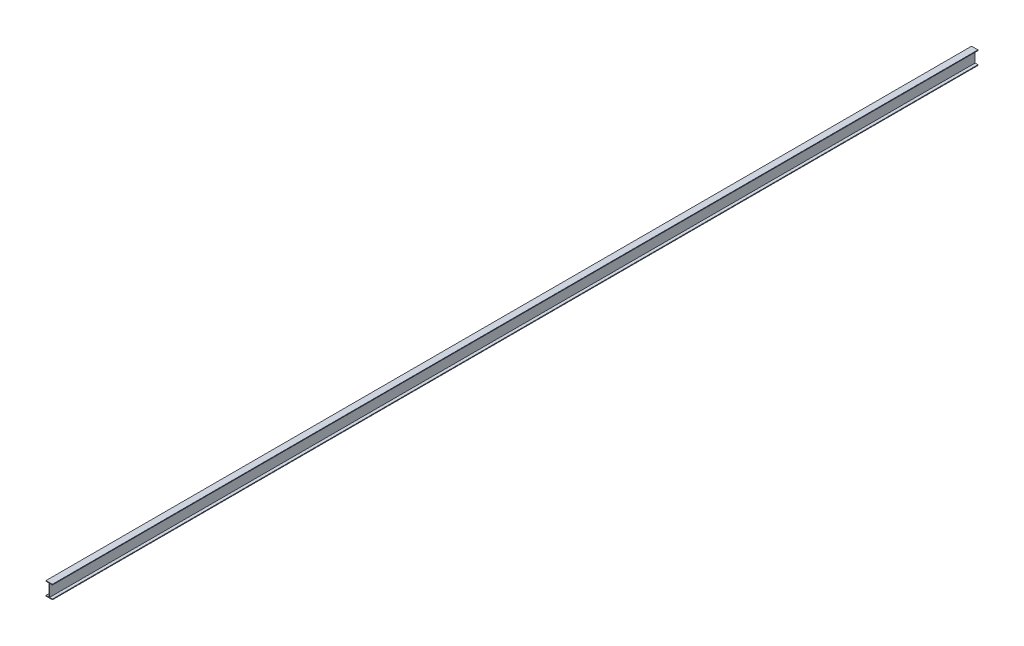
from build123d import *

# Parameters (mm, degrees)
SKETCH1_W             = 63.5
SKETCH1_H             = 6.35
EXTRUDE_THIN1_DEPTH   = 9144
SKETCH1_W_2           = 6.35
SKETCH1_H_2           = 127
EXTRUDE_THIN1_2_DEPTH = 9144
EXTRUDE_THIN1_3_DEPTH = 9144


with BuildPart() as part:
    # Sketch1 → Extrude-Thin1 (new body)
    with BuildSketch(Plane.XY):
        Rectangle(SKETCH1_W, SKETCH1_H)
    extrude(amount=EXTRUDE_THIN1_DEPTH)


with BuildPart() as body_2:
    # Sketch1 → Extrude-Thin1 2 (new body)
    with BuildSketch(Plane.XY):
        with Locations((0, -63.5)):
            Rectangle(SKETCH1_W_2, SKETCH1_H_2)
    extrude(amount=EXTRUDE_THIN1_2_DEPTH)


with BuildPart() as body_3:
    # Sketch1 → Extrude-Thin1 3 (new body)
    with BuildSketch(Plane.XY):
        with Locations((0, -127)):
            Rectangle(SKETCH1_W, SKETCH1_H)
    extrude(amount=EXTRUDE_THIN1_3_DEPTH)


solid = Compound([part.part, body_2.part, body_3.part])
